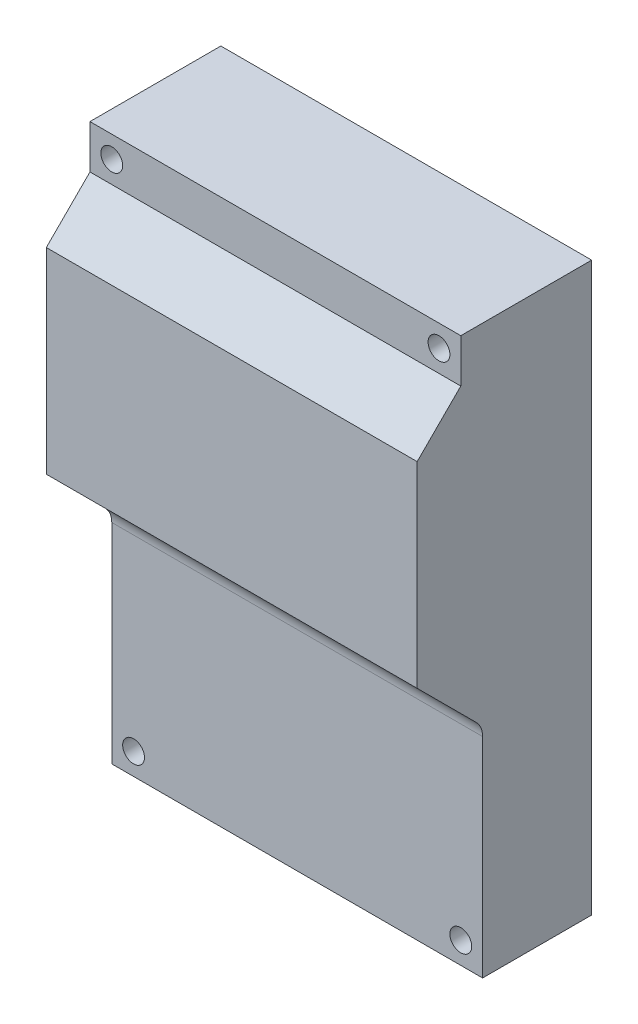
from build123d import *

# Parameters (mm, degrees)
SCHIZZO1_W                   = 85
SCHIZZO1_H                   = 130
SCHIZZO1_R                   = 2.5
ESTRUSIONE_ESTRUSIONE1_DEPTH = 40
TAGLIO_ESTRUSIONE1_DEPTH     = 115.236596588


with BuildPart() as part:
    # Schizzo1 → Estrusione-Estrusione1 (new body)
    with BuildSketch(Plane.XY):
        Rectangle(SCHIZZO1_W, SCHIZZO1_H)
        with Locations((-37.5, 60)):
            Circle(SCHIZZO1_R, mode=Mode.SUBTRACT)
        with Locations((37.5, 60)):
            Circle(SCHIZZO1_R, mode=Mode.SUBTRACT)
        with Locations((37.5, -60)):
            Circle(SCHIZZO1_R, mode=Mode.SUBTRACT)
        with Locations((-37.5, -60)):
            Circle(SCHIZZO1_R, mode=Mode.SUBTRACT)
    extrude(amount=ESTRUSIONE_ESTRUSIONE1_DEPTH)

    # Schizzo2 → Taglio-Estrusione1 (cut, through all)
    with BuildSketch(Plane(origin=(42.5, 0, 0), x_dir=(0, 0, -1), z_dir=(1, 0, 0))):
        Polygon((-40, 65), (-30, 65), (-30, 55), (-40, 45), align=None)
        with BuildLine():
            Line((-40, 0), (-40, -65))
            Line((-40, -65), (-25, -65))
            Line((-25, -65), (-25, -17.071067812))
            ThreePointArc((-25, -17.071067812), (-25.380602337, -15.15765065), (-26.464466094, -13.535533906))
            Line((-26.464466094, -13.535533906), (-40, 0))
        make_face()
    extrude(amount=-TAGLIO_ESTRUSIONE1_DEPTH, mode=Mode.SUBTRACT)


solid = part.part
